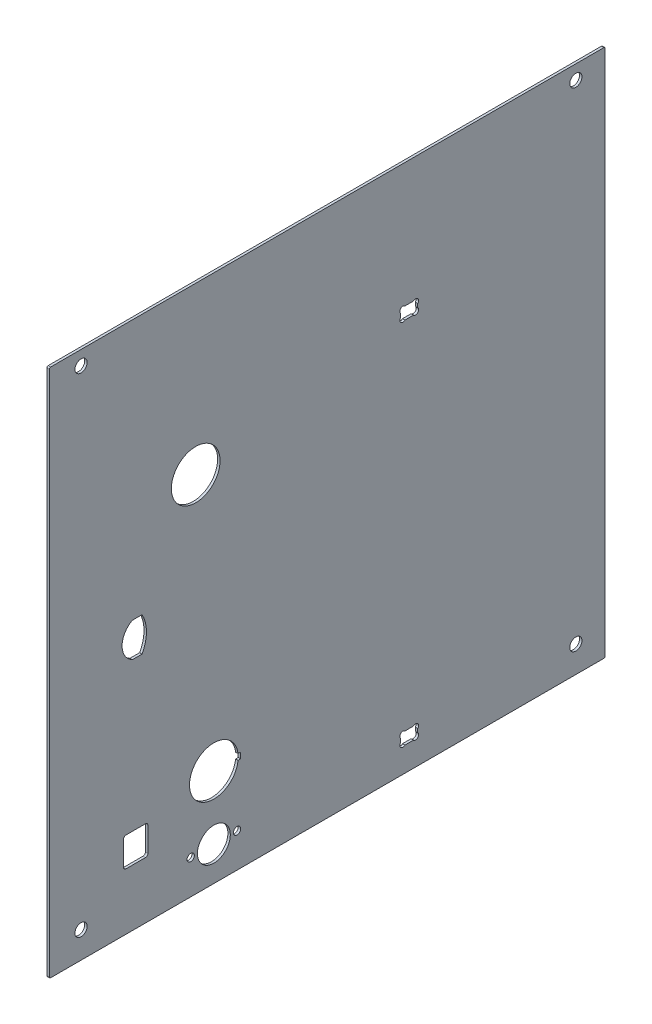
from build123d import *

# Parameters (mm, degrees)
SKETCH1_W           = 228
SKETCH1_H           = 217
SKETCH1_R           = 2.5
SKETCH1_R_2         = 6.75
SKETCH1_R_3         = 10
SKETCH1_R_4         = 1.5
SKETCH1_W_2         = 7
SKETCH1_H_2         = 5
BOSS_EXTRUDE1_DEPTH = 1
SKETCH5_R           = 1.25
CUT_EXTRUDE3_DEPTH  = 315.760226204
FILLET1_R           = 0.5


with BuildPart() as part:
    # Sketch1 → Boss-Extrude1 (new body)
    with BuildSketch(Plane(origin=(0, 0, 0), x_dir=(0, 0, -1), z_dir=(1, 0, 0))):
        with Locations((114, 108.5)):
            Rectangle(SKETCH1_W, SKETCH1_H)
        with Locations((13, 10.85)):
            Circle(SKETCH1_R, mode=Mode.SUBTRACT)
        with Locations((13, 211.15)):
            Circle(SKETCH1_R, mode=Mode.SUBTRACT)
        with Locations((67.5, 14)):
            Circle(SKETCH1_R_2, mode=Mode.SUBTRACT)
        with Locations((216, 10.85)):
            Circle(SKETCH1_R, mode=Mode.SUBTRACT)
        with Locations((216, 211.15)):
            Circle(SKETCH1_R, mode=Mode.SUBTRACT)
        with Locations((60.05, 149)):
            Circle(SKETCH1_R_3, mode=Mode.SUBTRACT)
        with Locations((77, 14)):
            Circle(SKETCH1_R_4, mode=Mode.SUBTRACT)
        with Locations((58, 14)):
            Circle(SKETCH1_R_4, mode=Mode.SUBTRACT)
        with Locations((147.63, 12.5)):
            Rectangle(SKETCH1_W_2, SKETCH1_H_2, mode=Mode.SUBTRACT)
        with Locations((147.63, 163.5)):
            Rectangle(SKETCH1_W_2, SKETCH1_H_2, mode=Mode.SUBTRACT)
        with BuildLine():
            Line((78.5, 41.2), (77.427738917, 41.2))
            ThreePointArc((77.427738917, 41.2), (66.898913138, 49.981918382), (57.5, 40))
            ThreePointArc((57.5, 40), (66.898913138, 30.018081618), (77.427738917, 38.8))
            Line((77.427738917, 38.8), (78.5, 38.8))
            Line((78.5, 38.8), (78.5, 41.2))
        make_face(mode=Mode.SUBTRACT)
    extrude(amount=BOSS_EXTRUDE1_DEPTH)

    # Sketch5 → Cut-Extrude3 (cut, through all)
    with BuildSketch(Plane(origin=(1, 0, 0), x_dir=(0, 0, -1), z_dir=(1, 0, 0))):
        with Locations((145.013883476, 165.116116524)):
            Circle(SKETCH5_R)
        with Locations((150.246116524, 165.116116524)):
            Circle(SKETCH5_R)
        with Locations((145.013883476, 161.883883476)):
            Circle(SKETCH5_R)
        with Locations((150.246116524, 161.883883476)):
            Circle(SKETCH5_R)
        with Locations((150.246116524, 14.116116524)):
            Circle(SKETCH5_R)
        with Locations((150.246116524, 10.883883476)):
            Circle(SKETCH5_R)
        with Locations((145.013883476, 10.883883476)):
            Circle(SKETCH5_R)
        with Locations((145.013883476, 14.116116524)):
            Circle(SKETCH5_R)
        with BuildLine():
            Line((34.05, 110.25), (38.05, 110.25))
            ThreePointArc((38.05, 110.25), (39.85, 103.25), (38.05, 96.25))
            Line((38.05, 96.25), (34.05, 96.25))
            ThreePointArc((34.05, 96.25), (29.85, 103.25), (34.05, 110.25))
        make_face()
        with BuildLine():
            Line((31.44, 35.265), (39.44, 35.265))
            ThreePointArc((39.44, 35.265), (40.147106781, 34.972106781), (40.44, 34.265))
            Line((40.44, 34.265), (40.44, 24.265))
            ThreePointArc((40.44, 24.265), (40.147106781, 23.557893219), (39.44, 23.265))
            Line((39.44, 23.265), (31.44, 23.265))
            ThreePointArc((31.44, 23.265), (30.732893219, 23.557893219), (30.44, 24.265))
            Line((30.44, 24.265), (30.44, 34.265))
            ThreePointArc((30.44, 34.265), (30.732893219, 34.972106781), (31.44, 35.265))
        make_face()
    extrude(amount=-CUT_EXTRUDE3_DEPTH, mode=Mode.SUBTRACT)

    # Fillet1
    fillet1_edges = [part.edges().sort_by_distance(p)[0] for p in [
        (0.5, 0, -228),
        (0.5, 0, 0),
        (0.5, 217, 0),
        (0.5, 217, -228),
    ]]
    fillet(fillet1_edges, radius=FILLET1_R)


solid = part.part
